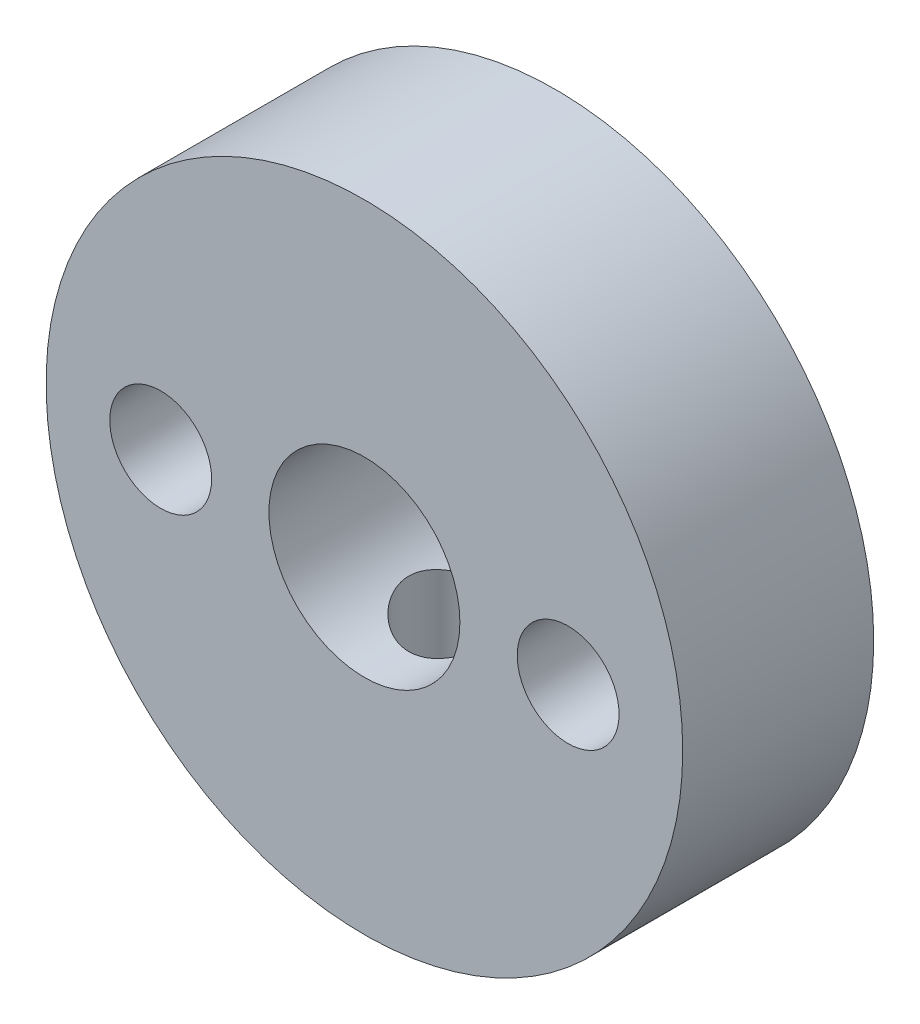
from build123d import *

# Parameters (mm, degrees)
SKETCH1_R           = 5
SKETCH1_R_2         = 1.5
EXTRUDE1_DEPTH      = 1.5
EXTRUDE2_DEPTH      = 8.228416147
EXTRUDE2_DEPTH_BACK = 8.228416147
SKETCH2_R           = 0.8
SKETCH3_R           = 0.8
EXTRUDE3_DEPTH      = 8.228416147


with BuildPart() as part:
    # Sketch1 → Extrude1 (new, symmetric)
    with BuildSketch(Plane.XY):
        Circle(SKETCH1_R)
        Circle(SKETCH1_R_2, mode=Mode.SUBTRACT)
    extrude(amount=EXTRUDE1_DEPTH, both=True)

    # Sketch2 → Extrude2 (cut, two sides: drawn at the far end of the back side and taken through both)
    with BuildSketch(Plane.XY.offset(-EXTRUDE2_DEPTH_BACK)):
        with Locations((-3.2, 0)):
            Circle(SKETCH2_R)
        with Locations((3.2, 0)):
            Circle(SKETCH2_R)
    extrude(amount=EXTRUDE2_DEPTH + EXTRUDE2_DEPTH_BACK, mode=Mode.SUBTRACT)

    # Sketch3 → Extrude3 (cut, through all)
    with BuildSketch(Plane(origin=(0, 0, 0), x_dir=(1, 0, 0), z_dir=(0, 1, 0))):
        with Locations(Location((0, 0, 0), (0, 0, 270))):
            Circle(SKETCH3_R)
    extrude(amount=-EXTRUDE3_DEPTH, mode=Mode.SUBTRACT)


solid = part.part
